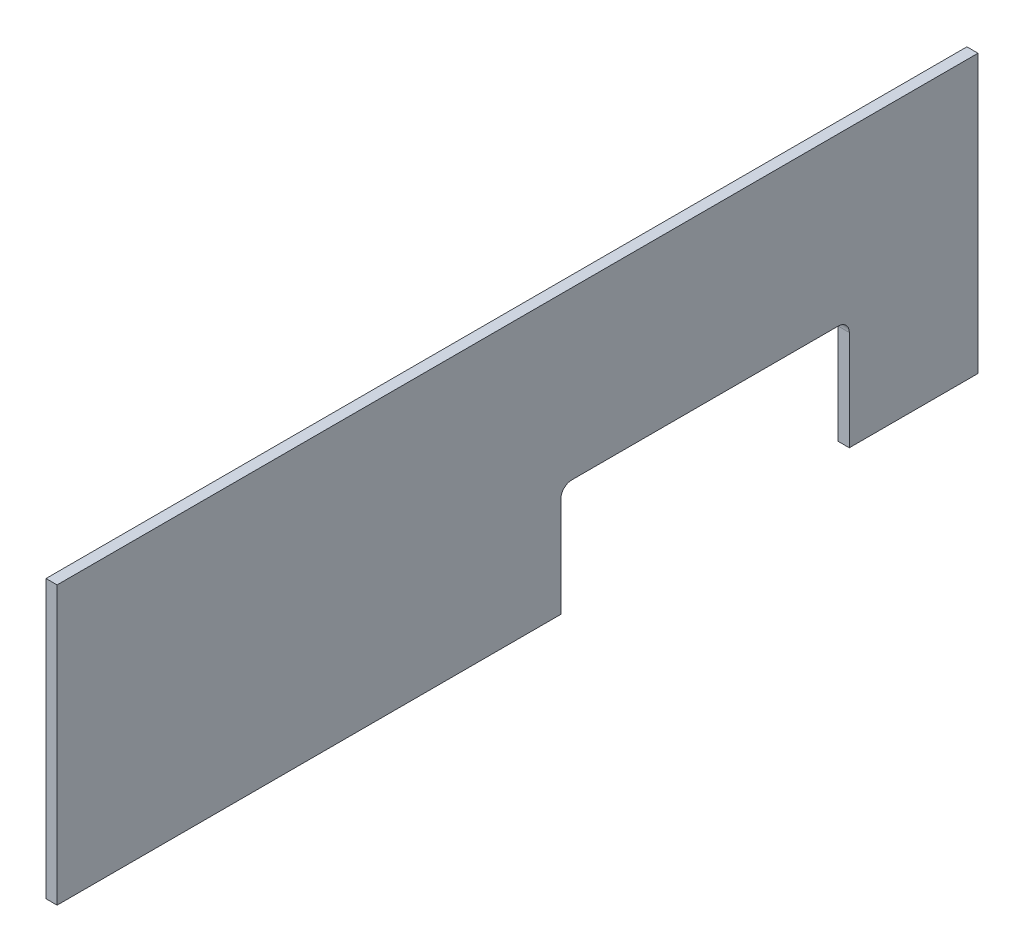
from build123d import *

# Parameters (mm, degrees)
BOSS_EXTRUDE1_DEPTH = 1
FILLET1_R           = 1


with BuildPart() as part:
    # Sketch1 → Boss-Extrude1 (new body)
    with BuildSketch(Plane(origin=(0, 0, 0), x_dir=(0, 0, -1), z_dir=(1, 0, 0))):
        Polygon((-41.5, 12.5), (-41.5, -12.5), (3.9, -12.5), (3.9, -2.5), (29.9, -2.5), (29.9, -12.5), (41.5, -12.5), (41.5, 12.5), align=None)
    extrude(amount=BOSS_EXTRUDE1_DEPTH)

    # Fillet1
    fillet1_edges = [part.edges().sort_by_distance(p)[0] for p in [
        (0.5, -2.5, -29.9),
        (0.5, -2.5, -3.9),
    ]]
    fillet(fillet1_edges, radius=FILLET1_R)


solid = part.part
